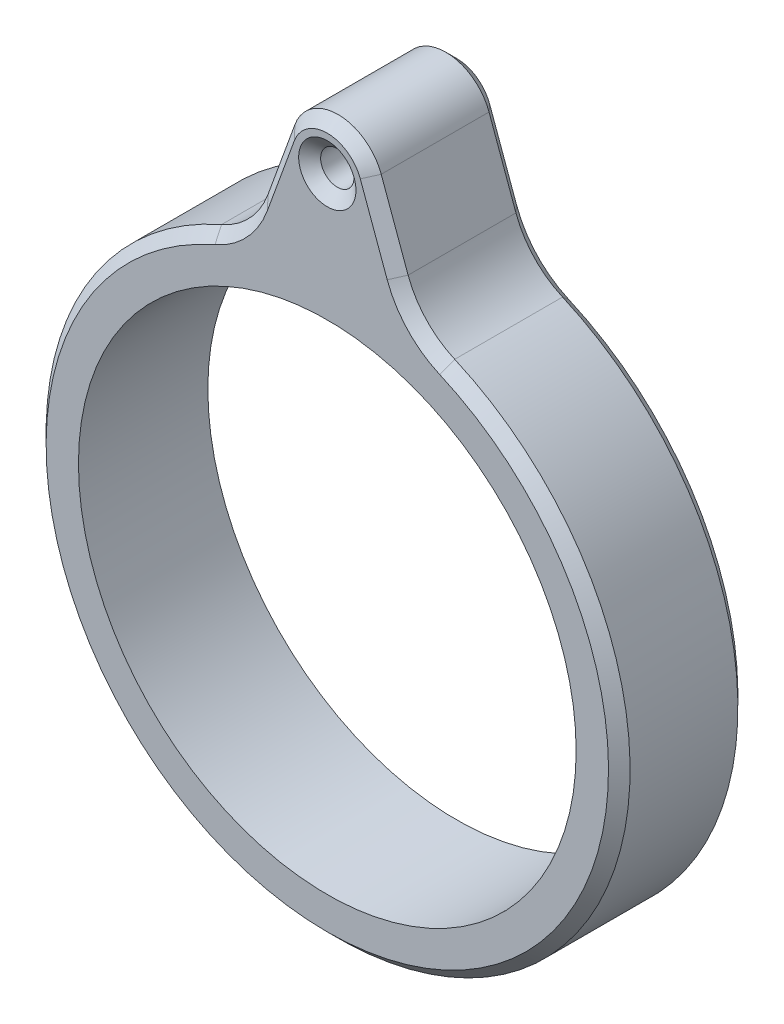
from build123d import *

# Parameters (mm, degrees)
SKETCH1_R                                         = 42.9895
SKETCH1_R_2                                       = 36.6395
BOSS_EXTRUDE1_DEPTH                               = 19.05
BOSS_EXTRUDE2_DEPTH                               = 19.05
FILLET1_R                                         = 12.7
CHAMFER1_SIZE                                     = 1.5875
CSK_FOR_8_FLAT_HEAD_MACHINE_SCREW_100_D           = 4.9149
CSK_FOR_8_FLAT_HEAD_MACHINE_SCREW_100_CSINK_D     = 8.4328
CSK_FOR_8_FLAT_HEAD_MACHINE_SCREW_100_CSINK_ANGLE = 100


with BuildPart() as part:
    # Sketch1 → Boss-Extrude1 (new body)
    with BuildSketch(Plane.XY):
        with Locations(Location((0, 0, 0), (0, 0, 180))):
            Circle(SKETCH1_R)
        with Locations(Location((0, 0, 0), (0, 0, 180))):
            Circle(SKETCH1_R_2, mode=Mode.SUBTRACT)
    extrude(amount=BOSS_EXTRUDE1_DEPTH)

    # Sketch3 → Boss-Extrude2 (add, through all)
    with BuildSketch(Plane.XY.offset(19.05)):
        with BuildLine():
            Line((-6.35, 57.593182132), (-12.321797405, 41.18580361))
            ThreePointArc((-12.321797405, 41.18580361), (0, 42.926029516), (12.321797405, 41.18580361))
            Line((12.321797405, 41.18580361), (6.35, 57.593182132))
            ThreePointArc((6.35, 57.593182132), (3.875959319, 60.817414721), (0, 62.0395))
            ThreePointArc((0, 62.0395), (-3.875959319, 60.817414721), (-6.35, 57.593182132))
        make_face()
    extrude(amount=-BOSS_EXTRUDE2_DEPTH)

    # Fillet1
    fillet1_edges = [part.edges().sort_by_distance(p)[0] for p in [
        (12.321797405, 41.18580361, 9.525),
        (-12.321797405, 41.18580361, 9.525),
    ]]
    fillet(fillet1_edges, radius=FILLET1_R)

    # Chamfer1
    chamfer1_edges = [part.edges().sort_by_distance(p)[0] for p in [
        (0, 62.0395, 0),
        (-8.330591024, 52.151553016, 0),
        (-8.330591024, 52.151553016, 19.05),
        (0, 62.0395, 19.05),
        (0, -42.9895, 0),
        (0, -42.9895, 19.05),
        (8.330591024, 52.151553016, 19.05),
        (8.330591024, 52.151553016, 0),
        (12.991632469, 42.355301831, 19.05),
        (12.991632469, 42.355301831, 0),
        (-12.991632469, 42.355301831, 19.05),
        (-12.991632469, 42.355301831, 0),
    ]]
    chamfer(chamfer1_edges, length=CHAMFER1_SIZE)

    # CSK for #8 Flat Head Machine Screw (100)1 (through all)
    with Locations(Plane.XY.offset(19.05)):
        with Locations((0, 55.281971145)):
            CounterSinkHole(CSK_FOR_8_FLAT_HEAD_MACHINE_SCREW_100_D / 2, CSK_FOR_8_FLAT_HEAD_MACHINE_SCREW_100_CSINK_D / 2, counter_sink_angle=CSK_FOR_8_FLAT_HEAD_MACHINE_SCREW_100_CSINK_ANGLE)


solid = part.part
